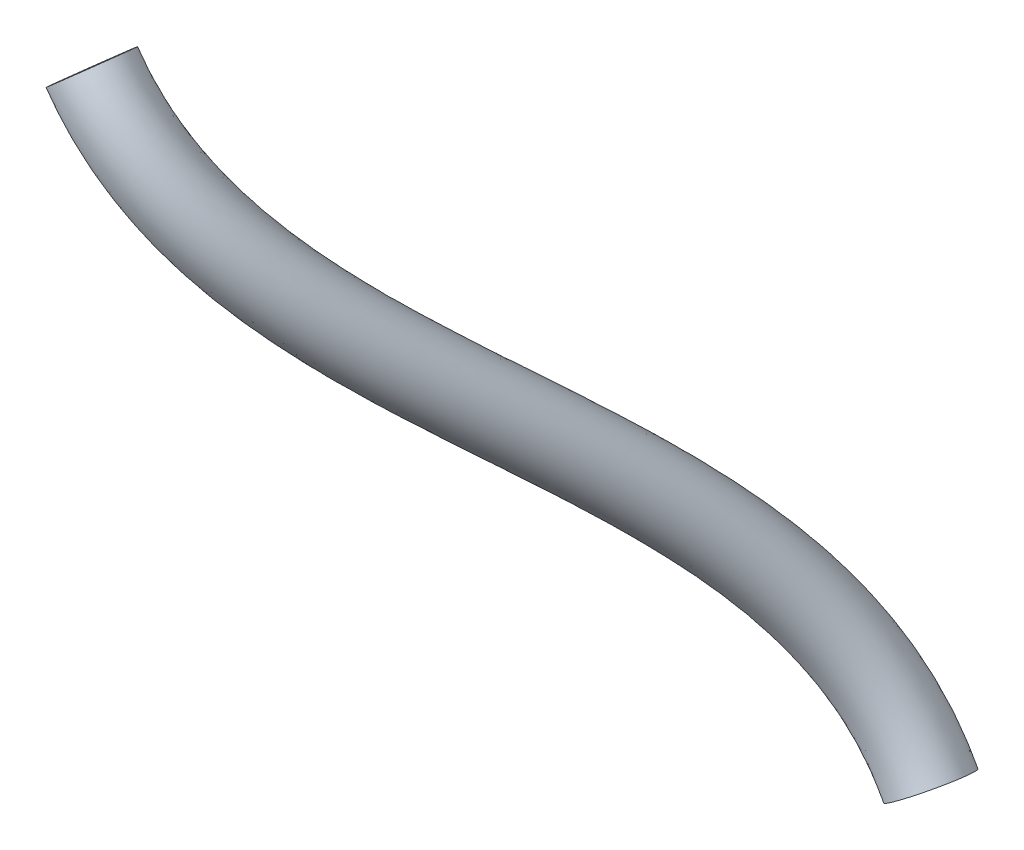
from build123d import *

# Parameters (mm, degrees)
SWEEP1_PROFILE_R = 4.75


with BuildPart() as part:
    # Sweep1: sweep along a curve in space
    with BuildLine() as sweep1_path:
        add(Edge.make_bspline(
            [(-328.155484411, -380.405237038, 493.76927549), (-350.588027105, -349.163388784, 489.884986505), (-366.065420675, -332.786796991, 546.06571588), (-391.25314586, -304.011500454, 542.961623286)],
            knots=[0, 0, 0, 0, 1, 1, 1, 1], degree=3))
    # Sweep1 profile (on start of the path) → Sweep1 (sweep)
    with BuildSketch(Plane(origin=(-328.155484411, -380.405237038, 493.76927549), x_dir=(0.8122929655265096, 0.5832496362246177, 0), z_dir=(-0.5802977965574565, 0.8081819323632181, -0.1004810007524596))):
        Circle(SWEEP1_PROFILE_R)
    sweep(path=sweep1_path.line)


solid = part.part
